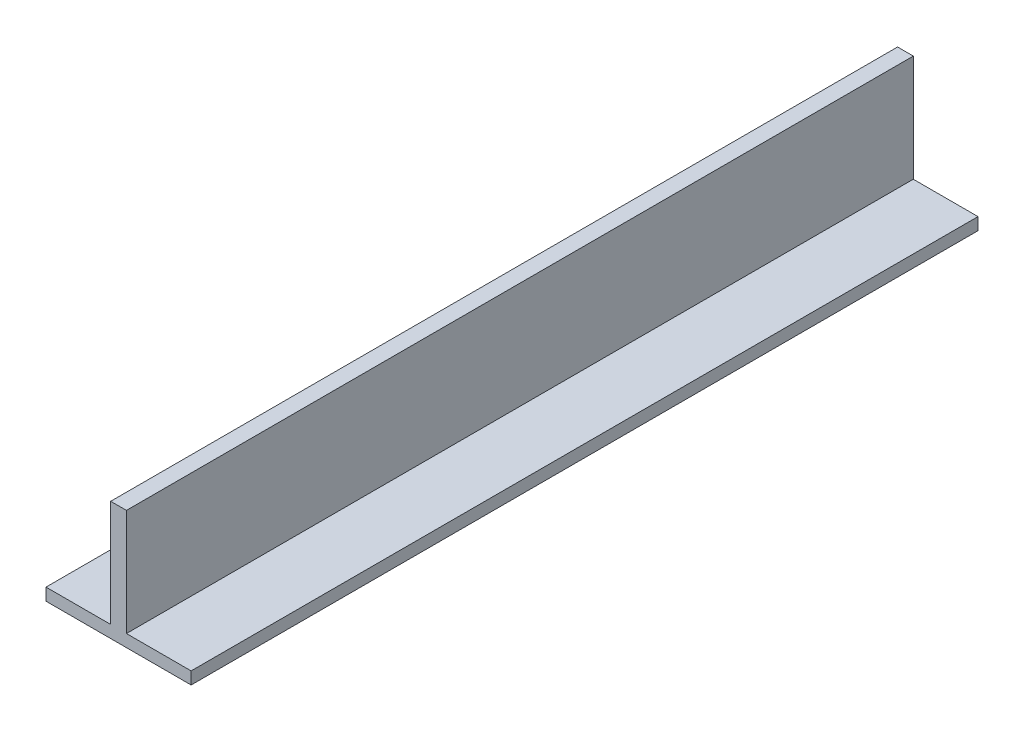
from build123d import *

# Parameters (mm, degrees)
BOSS_EXTRU_1_DEPTH      = 450
ESQUISSE2_W             = 37
ESQUISSE2_H             = 224
ENL_V_MAT_EXTRU_1_DEPTH = 7


with BuildPart() as part:
    # Esquisse1 → Boss.-Extru.1 (new body)
    with BuildSketch(Plane.XY):
        Polygon((0, 0), (83, 0), (83, 7), (46, 7), (46, 68), (37, 68), (37, 7), (0, 7), align=None)
    extrude(amount=BOSS_EXTRU_1_DEPTH)

    # Esquisse2 → Enlèv. mat.-Extru.1 (cut)
    with BuildSketch(Plane(origin=(0, 7, 0), x_dir=(1, 0, 0), z_dir=(0, 1, 0))):
        with Locations((18.5, -112)):
            Rectangle(ESQUISSE2_W, ESQUISSE2_H)
    extrude(amount=-ENL_V_MAT_EXTRU_1_DEPTH, mode=Mode.SUBTRACT)


solid = part.part
